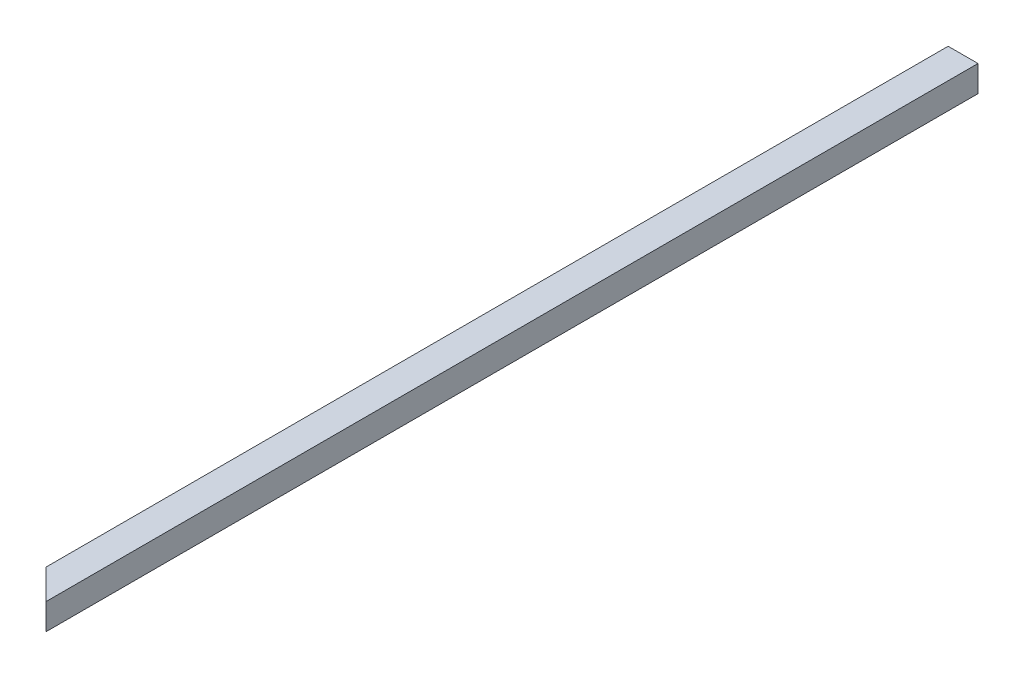
from build123d import *

# Parameters (mm, degrees)
CROQUIS1_W              = 4
CROQUIS1_H              = 3.5
SALIENTE_EXTRUIR1_DEPTH = 120.829699
SALIENTE_EXTRUIR2_DEPTH = 3.5


with BuildPart() as part:
    # Croquis1 → Saliente-Extruir1 (new body)
    with BuildSketch(Plane.XY):
        with Locations((85.98707047, -1.75)):
            Rectangle(CROQUIS1_W, CROQUIS1_H)
    extrude(amount=SALIENTE_EXTRUIR1_DEPTH)


with BuildPart() as saliente_extruir2_tool:
    # Croquis5 → Saliente-Extruir2 (new body)
    with BuildSketch(Plane.XZ.offset(3.5)):
        Polygon((83.98707047, 120.82969947), (87.98707047, 124.82969947), (87.98707047, 120.82969947), align=None)
    extrude(amount=-SALIENTE_EXTRUIR2_DEPTH)


with BuildPart() as part_1:
    add(part.part)


with BuildPart() as part_2:
    # Saliente-Extruir2: joined with saliente_extruir2_tool
    add(part_1.part.fuse(saliente_extruir2_tool.part, tol=0.00001))


solid = part_2.part
